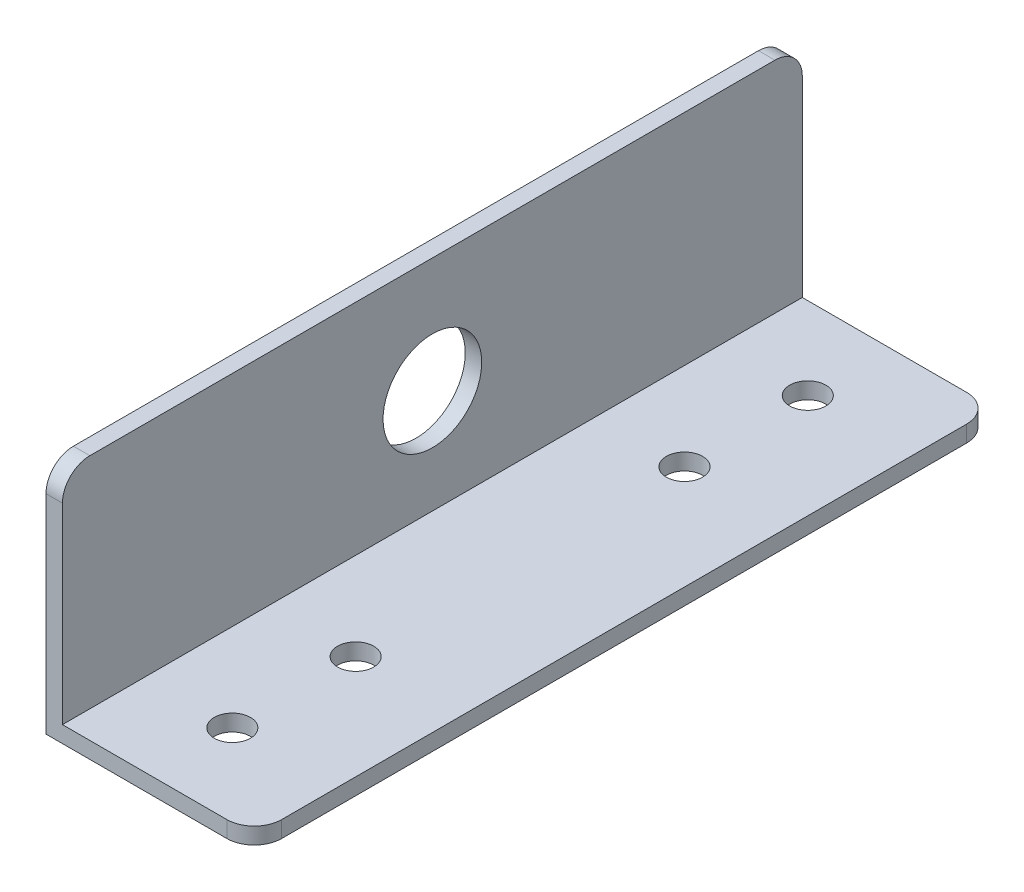
from build123d import *

# Parameters (mm, degrees)
EXTRUDE_1_DEPTH     = 135
SKETCH_3_R          = 18
CUT_EXTRUDE_2_DEPTH = 175.702604445
SKETCH_4_R          = 6.6
CUT_EXTRUDE_3_DEPTH = 175.358825415
FILLET_1_R          = 10


with BuildPart() as part:
    # Эскиз1 → Бобышка-Вытянуть1 (new, symmetric)
    with BuildSketch(Plane.XY):
        Polygon((0, 0), (76, 0), (76, 6), (6, 6), (6, 86), (0, 86), align=None)
    extrude(amount=EXTRUDE_1_DEPTH, both=True)

    # Эскиз3 → Вырез-Вытянуть2 (cut, through all)
    with BuildSketch(Plane(origin=(6, 0, 0), x_dir=(0, 0, -1), z_dir=(1, 0, 0))):
        with Locations(Location((0, 44, 0), (0, 0, 90))):
            Circle(SKETCH_3_R)
    extrude(amount=-CUT_EXTRUDE_2_DEPTH, mode=Mode.SUBTRACT)

    # Эскиз4 → Вырез-Вытянуть3 (cut, through all)
    with BuildSketch(Plane(origin=(0, 6, 0), x_dir=(1, 0, 0), z_dir=(0, 1, 0))):
        with Locations(Location((38, 105, 0), (0, 0, 180))):
            Circle(SKETCH_4_R)
        with Locations((38, 60)):
            Circle(SKETCH_4_R)
        with Locations(Location((38, -60, 0), (0, 0, 180))):
            Circle(SKETCH_4_R)
        with Locations((38, -105)):
            Circle(SKETCH_4_R)
    extrude(amount=-CUT_EXTRUDE_3_DEPTH, mode=Mode.SUBTRACT)

    # Скругление1
    fillet_1_edges = [part.edges().sort_by_distance(p)[0] for p in [
        (76, 3, 135),
        (3, 86, 135),
        (3, 86, -135),
        (76, 3, -135),
    ]]
    fillet(fillet_1_edges, radius=FILLET_1_R)


solid = part.part
